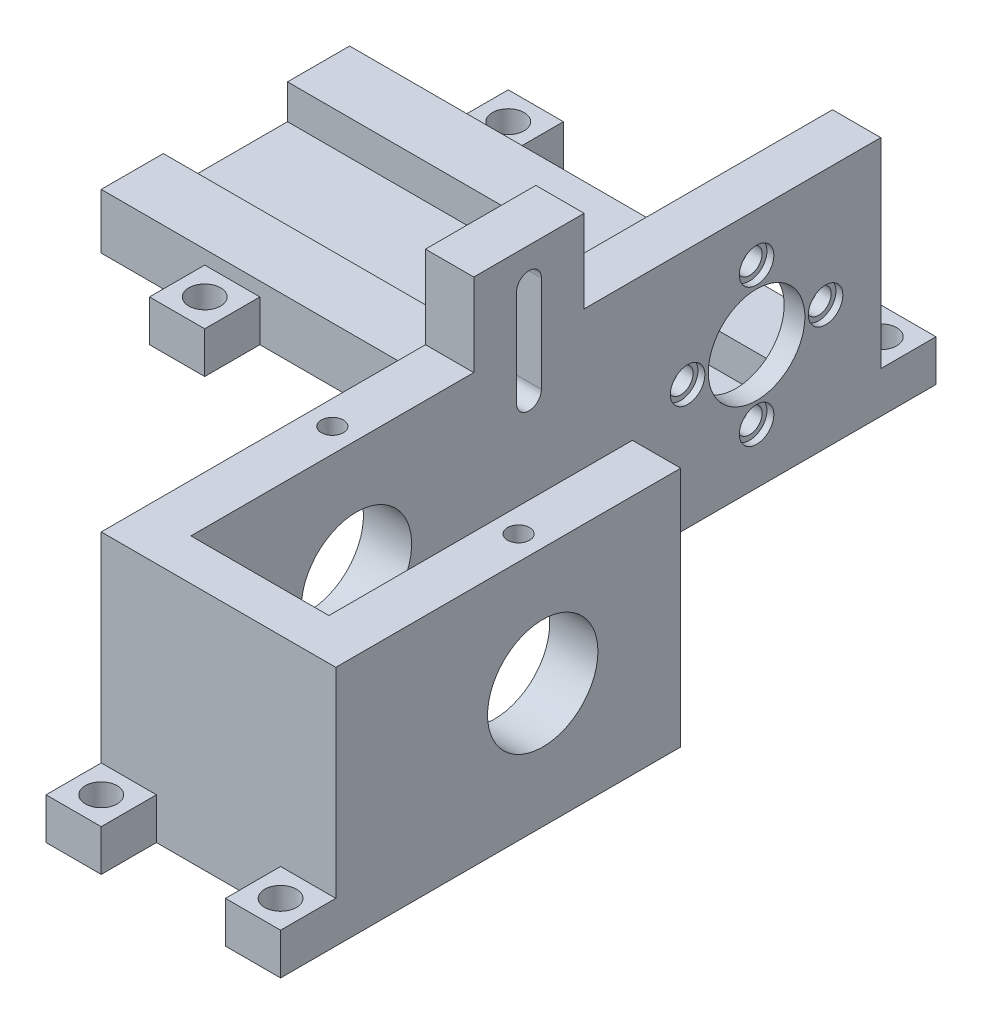
from build123d import *

# Parameters (mm, degrees)
BOSS_EXTRU_1_DEPTH      = 35
ESQUISSE2_R             = 8
ENL_V_MAT_EXTRU_1_DEPTH = 28
ESQUISSE4_R             = 1.8
ENL_V_MAT_EXTRU_2_DEPTH = 10
ESQUISSE4_3_R           = 13.4
ESQUISSE4_3_R_2         = 1.8
ESQUISSE4_3_R_3         = 7
ENL_V_MAT_EXTRU_3_DEPTH = 4
ESQUISSE4_4_R           = 7
ENL_V_MAT_EXTRU_4_DEPTH = 10
BOSS_EXTRU_2_DEPTH      = 55
ESQUISSE8_W             = 8
ESQUISSE8_H             = 8
ESQUISSE8_R             = 2.3
BOSS_EXTRU_3_DEPTH      = 6
ESQUISSE10_W            = 16
ESQUISSE10_H            = 12
BOSS_EXTRU_4_DEPTH      = 7
ENL_V_MAT_EXTRU_5_DEPTH = 10
ESQUISSE11_R            = 1.6
ENL_V_MAT_EXTRU_6_DEPTH = 10
ESQUISSE12_R            = 2.5
ENL_V_MAT_EXTRU_7_DEPTH = 1
ESQUISSE15_R            = 8
ENL_V_MAT_EXTRU_8_DEPTH = 10
BOSS_EXTRU_5_DEPTH      = 15


with BuildPart() as part:
    # Esquisse1 → Boss.-Extru.1 (new body)
    with BuildSketch(Plane(origin=(0, 0, 0), x_dir=(1, 0, 0), z_dir=(0, 1, 0))):
        Polygon((-17, 0), (17, 0), (17, 50), (10, 50), (10, 6), (-10, 6), (-10, 106), (-17, 106), align=None)
    extrude(amount=BOSS_EXTRU_1_DEPTH)

    # Esquisse2 → Enlèv. mat.-Extru.1 (cut)
    with BuildSketch(Plane(origin=(17, 0, 0), x_dir=(0, 0, -1), z_dir=(1, 0, 0))):
        with Locations((30, 18)):
            Circle(ESQUISSE2_R)
    extrude(amount=-ENL_V_MAT_EXTRU_1_DEPTH, mode=Mode.SUBTRACT)

    # Esquisse4 → Enlèv. mat.-Extru.2 (cut)
    with BuildSketch(Plane.ZY.offset(17)):
        with Locations((-88, 8)):
            Circle(ESQUISSE4_R)
        with Locations((-78, 18)):
            Circle(ESQUISSE4_R)
        with Locations((-88, 28)):
            Circle(ESQUISSE4_R)
        with Locations((-98, 18)):
            Circle(ESQUISSE4_R)
    extrude(amount=-ENL_V_MAT_EXTRU_2_DEPTH, mode=Mode.SUBTRACT)

    # Esquisse4<3> → Enlèv. mat.-Extru.3 (cut)
    with BuildSketch(Plane.ZY.offset(17)):
        with Locations((-88, 18)):
            Circle(ESQUISSE4_3_R)
        with Locations((-88, 8)):
            Circle(ESQUISSE4_3_R_2, mode=Mode.SUBTRACT)
        with Locations((-98, 18)):
            Circle(ESQUISSE4_3_R_2, mode=Mode.SUBTRACT)
        with Locations((-88, 18)):
            Circle(ESQUISSE4_3_R_3, mode=Mode.SUBTRACT)
        with Locations((-88, 28)):
            Circle(ESQUISSE4_3_R_2, mode=Mode.SUBTRACT)
        with Locations((-78, 18)):
            Circle(ESQUISSE4_3_R_2, mode=Mode.SUBTRACT)
    extrude(amount=-ENL_V_MAT_EXTRU_3_DEPTH, mode=Mode.SUBTRACT)

    # Esquisse4<4> → Enlèv. mat.-Extru.4 (cut)
    with BuildSketch(Plane.ZY.offset(17)):
        with Locations((-88, 18)):
            Circle(ESQUISSE4_4_R)
    extrude(amount=-ENL_V_MAT_EXTRU_4_DEPTH, mode=Mode.SUBTRACT)

    # Esquisse4<11> → Boss.-Extru.2 (add)
    with BuildSketch(Plane.ZY.offset(17)):
        Polygon((-70, 0), (-70, 8), (-79, 8), (-79, 3), (-97, 3), (-97, 8), (-106, 8), (-106, 0), align=None)
    extrude(amount=BOSS_EXTRU_2_DEPTH)

    # Esquisse8 → Boss.-Extru.3 (add)
    # profile 1 of 5: a face of its own
    with BuildSketch(Plane.XZ):
        with Locations((13, 4)):
            Rectangle(ESQUISSE8_W, ESQUISSE8_H)
        with Locations((13, 4)):
            Circle(ESQUISSE8_R, mode=Mode.SUBTRACT)
    # profile 2 of 5: a face of its own
    with BuildSketch(Plane.XZ):
        with Locations((-13, 4)):
            Rectangle(ESQUISSE8_W, ESQUISSE8_H)
        with Locations((-13, 4)):
            Circle(ESQUISSE8_R, mode=Mode.SUBTRACT)
    # profile 3 of 5: a face of its own
    with BuildSketch(Plane.XZ):
        with Locations((-68, -110)):
            Rectangle(ESQUISSE8_W, ESQUISSE8_H)
        with Locations((-68, -110)):
            Circle(ESQUISSE8_R, mode=Mode.SUBTRACT)
    # profile 4 of 5: a face of its own
    with BuildSketch(Plane.XZ):
        with Locations((-68, -66)):
            Rectangle(ESQUISSE8_W, ESQUISSE8_H)
        with Locations((-68, -66)):
            Circle(ESQUISSE8_R, mode=Mode.SUBTRACT)
    # profile 5 of 5: a face of its own
    with BuildSketch(Plane.XZ):
        with Locations((-14, -110)):
            Rectangle(ESQUISSE8_W, ESQUISSE8_H)
        with Locations((-14, -110)):
            Circle(ESQUISSE8_R, mode=Mode.SUBTRACT)
    extrude(amount=-BOSS_EXTRU_3_DEPTH)

    # Esquisse10 → Boss.-Extru.4 (add)
    with BuildSketch(Plane.ZY.offset(17)):
        with Locations((-55, 41)):
            Rectangle(ESQUISSE10_W, ESQUISSE10_H)
    extrude(amount=-BOSS_EXTRU_4_DEPTH)

    # Esquisse9 → Enlèv. mat.-Extru.5 (cut)
    with BuildSketch(Plane.ZY.offset(17)):
        with BuildLine():
            Line((-56.8, 42), (-56.8, 28))
            ThreePointArc((-56.8, 28), (-55, 26.2), (-53.2, 28))
            Line((-53.2, 28), (-53.2, 42))
            ThreePointArc((-53.2, 42), (-55, 43.8), (-56.8, 42))
        make_face()
    extrude(amount=-ENL_V_MAT_EXTRU_5_DEPTH, mode=Mode.SUBTRACT)

    # Esquisse11 → Enlèv. mat.-Extru.6 (cut)
    with BuildSketch(Plane(origin=(0, 35, 0), x_dir=(1, 0, 0), z_dir=(0, 1, 0))):
        with Locations((-13.5, 30)):
            Circle(ESQUISSE11_R)
        with Locations((13.5, 30)):
            Circle(ESQUISSE11_R)
    extrude(amount=-ENL_V_MAT_EXTRU_6_DEPTH, mode=Mode.SUBTRACT)

    # Esquisse12 → Enlèv. mat.-Extru.7 (cut)
    with BuildSketch(Plane(origin=(-10, 0, 0), x_dir=(0, 0, -1), z_dir=(1, 0, 0))):
        with Locations((88, 28)):
            Circle(ESQUISSE12_R)
        with Locations((98, 18)):
            Circle(ESQUISSE12_R)
        with Locations((88, 8)):
            Circle(ESQUISSE12_R)
        with Locations((78, 18)):
            Circle(ESQUISSE12_R)
    extrude(amount=-ENL_V_MAT_EXTRU_7_DEPTH, mode=Mode.SUBTRACT)

    # Esquisse15 → Enlèv. mat.-Extru.8 (cut)
    with BuildSketch(Plane(origin=(-11, 0, 0), x_dir=(0, 0, -1), z_dir=(1, 0, 0))):
        with Locations((30, 18)):
            Circle(ESQUISSE15_R)
    extrude(amount=-ENL_V_MAT_EXTRU_8_DEPTH, mode=Mode.SUBTRACT)

    # Esquisse16 → Boss.-Extru.5 (add)
    with BuildSketch(Plane.ZY.offset(72)):
        Polygon((-106, 8), (-106, 0), (-70, 0), (-70, 8), (-79, 8), (-79, 3), (-97, 3), (-97, 8), align=None)
    extrude(amount=BOSS_EXTRU_5_DEPTH)


solid = part.part
